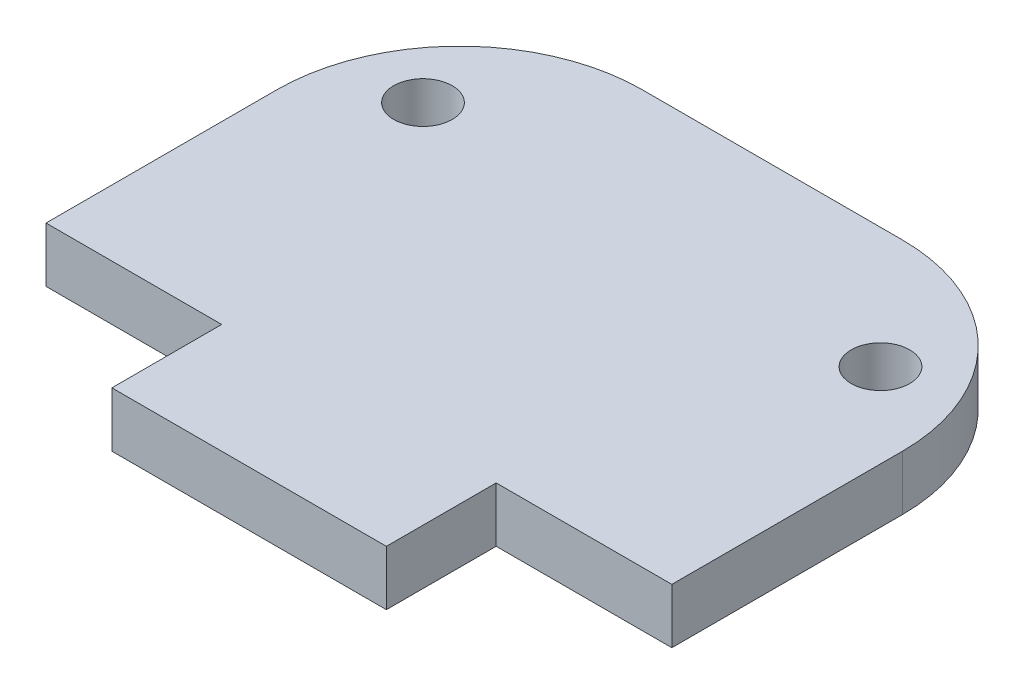
from build123d import *

# Parameters (mm, degrees)
ESBO_O1_R                = 1.6
RESSALTO_EXTRUS_O1_DEPTH = 3


with BuildPart() as part:
    # Esboço1 → Ressalto-extrusão1 (new body)
    with BuildSketch(Plane.XZ.offset(3)):
        with BuildLine():
            Line((-7.1, -28.6), (7.1, -28.6))
            ThreePointArc((7.1, -28.6), (14.171067812, -25.671067812), (17.1, -18.6))
            Line((17.1, -18.6), (17.1, -6))
            Line((17.1, -6), (7.5, -6))
            Line((7.5, -6), (7.5, 0))
            Line((7.5, 0), (-7.5, 0))
            Line((-7.5, 0), (-7.5, -6))
            Line((-7.5, -6), (-17.1, -6))
            Line((-17.1, -6), (-17.1, -18.6))
            ThreePointArc((-17.1, -18.6), (-14.171067812, -25.671067812), (-7.1, -28.6))
        make_face()
        with Locations(Location((-12.5, -22, 0), (0, 0, 270))):
            Circle(ESBO_O1_R, mode=Mode.SUBTRACT)
        with Locations(Location((12.5, -22, 0), (0, 0, 270))):
            Circle(ESBO_O1_R, mode=Mode.SUBTRACT)
    extrude(amount=-RESSALTO_EXTRUS_O1_DEPTH)


solid = part.part
